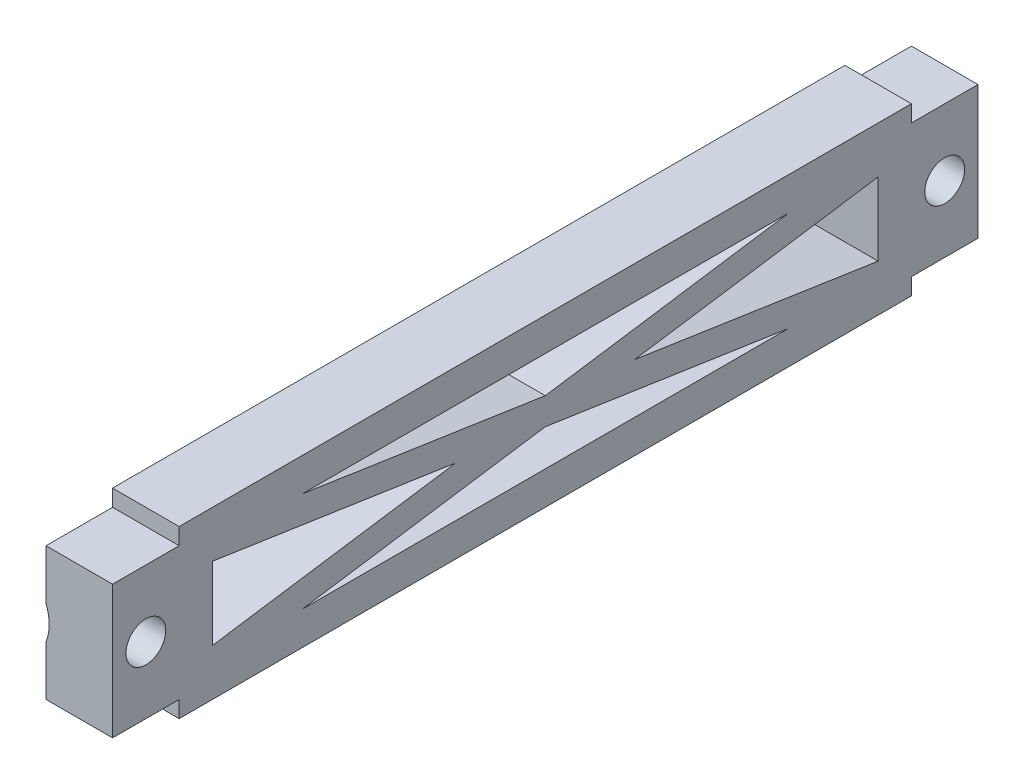
from build123d import *

# Parameters (mm, degrees)
BOSS_EXTRUDE1_DEPTH                               = 6.35
CSK_FOR_6_FLAT_HEAD_MACHINE_SCREW_100_D           = 3.7973
CSK_FOR_6_FLAT_HEAD_MACHINE_SCREW_100_CSINK_D     = 7.0866
CSK_FOR_6_FLAT_HEAD_MACHINE_SCREW_100_CSINK_ANGLE = 100
CUT_EXTRUDE1_DEPTH                                = 85.302079601


with BuildPart() as part:
    # Sketch1 → Boss-Extrude1 (new body)
    with BuildSketch(Plane(origin=(0, 0, 0), x_dir=(0, 0, -1), z_dir=(1, 0, 0))):
        Polygon((76.2, 15.875), (41.275, 15.875), (41.275, 0), (76.2, 0), (76.2, 1.5875), (82.55, 1.5875), (82.55, 14.2875), (76.2, 14.2875), align=None)
        Polygon((41.275, 0), (41.275, 15.875), (6.35, 15.875), (6.35, 14.2875), (0, 14.2875), (0, 1.5875), (6.35, 1.5875), (6.35, 0), align=None)
    extrude(amount=BOSS_EXTRUDE1_DEPTH)

    # CSK for #6 Flat Head Machine Screw (100)1 (through all)
    with Locations(Plane.ZY):
        with Locations((-79.375, 7.9375), (-3.175, 7.9375)):
            CounterSinkHole(CSK_FOR_6_FLAT_HEAD_MACHINE_SCREW_100_D / 2, CSK_FOR_6_FLAT_HEAD_MACHINE_SCREW_100_CSINK_D / 2, counter_sink_angle=CSK_FOR_6_FLAT_HEAD_MACHINE_SCREW_100_CSINK_ANGLE)

    # Sketch4 → Cut-Extrude1 (cut, through all)
    with BuildSketch(Plane.ZY):
        Polygon((-49.83638683, 7.9375), (-73.025, 11.415791976), (-73.025, 4.459208024), align=None)
        Polygon((-18.08638683, 12.7), (-64.46361317, 12.7), (-41.275, 9.221708024), align=None)
        Polygon((-9.525, 11.415791976), (-32.71361317, 7.9375), (-9.525, 4.459208024), align=None)
        Polygon((-18.08638683, 3.175), (-41.275, 6.653291976), (-64.46361317, 3.175), align=None)
    extrude(amount=-CUT_EXTRUDE1_DEPTH, mode=Mode.SUBTRACT)


solid = part.part
